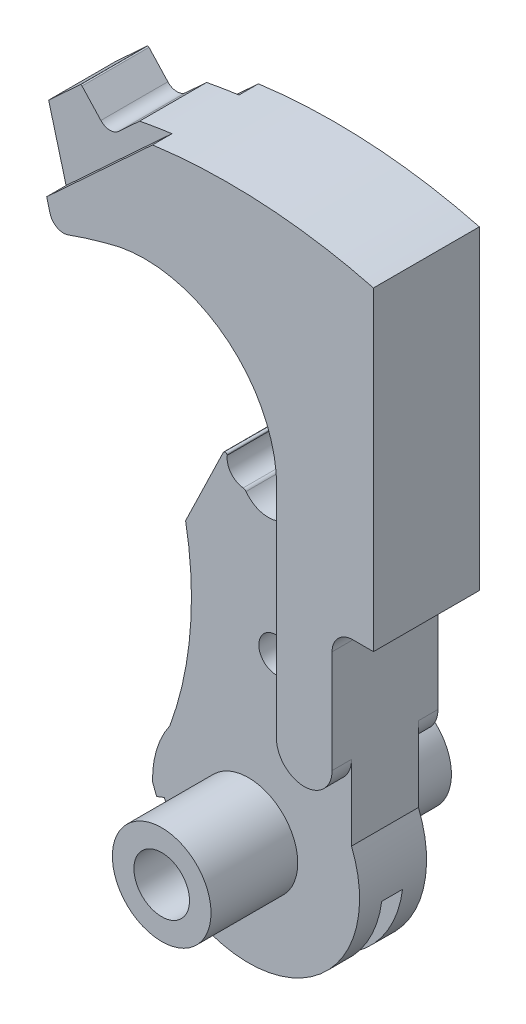
from build123d import *

# Parameters (mm, degrees)
SKETCH1_R               = 2
BOSS_EXTRUDE2_DEPTH     = 8.65
CUT_EXTRUDE3_START      = -4.84
SKETCH21_R              = 3.55
CUT_EXTRUDE3_DEPTH      = 4.84
SKETCH18_R              = 3.55
CUT_EXTRUDE4_DEPTH      = 4.84
SKETCH27_R              = 3.55
CUT_EXTRUDE7_DEPTH      = 1.4
CUT_EXTRUDE8_START      = -1.4
SKETCH29_R              = 3.55
CUT_EXTRUDE8_DEPTH      = 1.4
CUT_EXTRUDE9_DEPTH      = 45.578250281
CUT_EXTRUDE9_DEPTH_BACK = 45.578250281
SKETCH6_R               = 1.25
CUT_EXTRUDE10_DEPTH     = 0.75


with BuildPart() as part:
    # Sketch1 → Boss-Extrude2 (new, symmetric)
    with BuildSketch(Plane.XY):
        with BuildLine():
            ThreePointArc((-5.651629818, 3.958418927), (-6.605289058, 1.995032948), (-6.897954559, -0.167996721))
            Line((-6.897954559, -0.167996721), (-6.605824697, -0.929021032))
            Line((-6.605824697, -0.929021032), (-6.069015951, -0.722959461))
            ThreePointArc((-6.069015951, -0.722959461), (-6.049888336, -0.723460336), (-6.036717242, -0.737339773))
            Line((-6.036717242, -0.737339773), (-5.517083715, -2.091031392))
            ThreePointArc((-5.517083715, -2.091031392), (-5.517584589, -2.110159006), (-5.531464027, -2.123330101))
            Line((-5.531464027, -2.123330101), (-7.419958348, -2.848255151))
            Line((-7.419958348, -2.848255151), (-6.027342222, -5.260337036))
            ThreePointArc((-6.027342222, -5.260337036), (4.183814464, -6.818775296), (7.42, 2.990585227))
            Line((7.42, 2.990585227), (7.42, 9.395292614))
            Line((7.42, 9.395292614), (7.42, 15.8))
            ThreePointArc((7.42, 15.8), (7.859339828, 16.860660172), (8.92, 17.3))
            Line((8.92, 17.3), (10.4, 17.3))
            Line((10.4, 17.3), (10.4, 39.969113075))
            ThreePointArc((10.4, 39.969113075), (1.317615366, 41.278976365), (-7.82981649, 40.551004596))
            Line((-7.82981649, 40.551004596), (-9.346087248, 39.150359553))
            ThreePointArc((-9.346087248, 39.150359553), (-9.992424937, 38.912169279), (-10.617880658, 39.200773083))
            Line((-10.617880658, 39.200773083), (-11.974969412, 40.669891905))
            ThreePointArc((-11.974969412, 40.669891905), (-12.044464492, 40.701958995), (-12.116279791, 40.675493408))
            Line((-12.116279791, 40.675493408), (-14.377339743, 38.586854295))
            Line((-14.377339743, 38.586854295), (-12.872946932, 32.972383888))
            ThreePointArc((-12.872946932, 32.972383888), (-12.370989585, 32.345351225), (-11.569711725, 32.289809083))
            ThreePointArc((-11.569711725, 32.289809083), (-9.741406245, 32.887611716), (-7.882463977, 33.38198259))
            ThreePointArc((-7.882463977, 33.38198259), (-0.014271933, 31.38535878), (3.438957848, 24.038920408))
            Line((3.438957848, 24.038920408), (3.438957848, 22.483224896))
            ThreePointArc((3.438957848, 22.483224896), (2.06450625, 20.583569875), (-0.169731349, 21.294898734))
            ThreePointArc((-0.169731349, 21.294898734), (-0.261150212, 21.376524071), (-0.377583309, 21.41477898))
            ThreePointArc((-0.377583309, 21.41477898), (-1.257242701, 21.906570189), (-1.521126803, 22.879208054))
            Line((-1.521126803, 22.879208054), (-1.537067384, 22.913392739))
            ThreePointArc((-1.537067384, 22.913392739), (-1.671971186, 22.999996378), (-1.808065565, 22.91527598))
            Line((-1.808065565, 22.91527598), (-4.520599254, 17.303209571))
            ThreePointArc((-4.520599254, 17.303209571), (-4.190739584, 10.554927226), (-5.651629818, 3.958418927))
        make_face()
        Circle(SKETCH1_R, mode=Mode.SUBTRACT)
    extrude(amount=BOSS_EXTRUDE2_DEPTH, both=True)

    # Sketch21 → Cut-Extrude3 (cut)
    with BuildSketch(Plane(origin=(0, 0, -8.65), x_dir=(-1, 0, 0), z_dir=(0, 0, -1)).offset(CUT_EXTRUDE3_START)):
        with BuildLine():
            Line((12.872946932, 32.972383888), (14.377339743, 38.586854295))
            Line((14.377339743, 38.586854295), (12.116279791, 40.675493408))
            ThreePointArc((12.116279791, 40.675493408), (12.044464492, 40.701958995), (11.974969412, 40.669891905))
            Line((11.974969412, 40.669891905), (10.617880658, 39.200773083))
            ThreePointArc((10.617880658, 39.200773083), (9.992424937, 38.912169279), (9.346087248, 39.150359553))
            Line((9.346087248, 39.150359553), (7.82981649, 40.551004596))
            ThreePointArc((7.82981649, 40.551004596), (-1.317615366, 41.278976365), (-10.4, 39.969113075))
            Line((-10.4, 39.969113075), (-10.4, 17.3))
            Line((-10.4, 17.3), (-8.92, 17.3))
            ThreePointArc((-8.92, 17.3), (-7.859339828, 16.860660172), (-7.42, 15.8))
            Line((-7.42, 15.8), (-7.42, 9.395292614))
            Line((-7.42, 9.395292614), (-7.42, 2.990585227))
            ThreePointArc((-7.42, 2.990585227), (-4.183814464, -6.818775296), (6.027342222, -5.260337036))
            Line((6.027342222, -5.260337036), (7.419958348, -2.848255151))
            Line((7.419958348, -2.848255151), (5.531464027, -2.123330101))
            ThreePointArc((5.531464027, -2.123330101), (5.517584589, -2.110159006), (5.517083715, -2.091031392))
            Line((5.517083715, -2.091031392), (6.036717242, -0.737339773))
            ThreePointArc((6.036717242, -0.737339773), (6.049888336, -0.723460336), (6.069015951, -0.722959461))
            Line((6.069015951, -0.722959461), (6.605824697, -0.929021032))
            Line((6.605824697, -0.929021032), (6.897954559, -0.167996721))
            ThreePointArc((6.897954559, -0.167996721), (6.605289058, 1.995032948), (5.651629818, 3.958418927))
            ThreePointArc((5.651629818, 3.958418927), (4.190739584, 10.554927226), (4.520599254, 17.303209571))
            Line((4.520599254, 17.303209571), (1.808065565, 22.91527598))
            ThreePointArc((1.808065565, 22.91527598), (1.671971186, 22.999996378), (1.537067384, 22.913392739))
            Line((1.537067384, 22.913392739), (1.521126803, 22.879208054))
            ThreePointArc((1.521126803, 22.879208054), (1.257242701, 21.906570189), (0.377583309, 21.41477898))
            ThreePointArc((0.377583309, 21.41477898), (0.261150212, 21.376524071), (0.169731349, 21.294898734))
            ThreePointArc((0.169731349, 21.294898734), (-2.06450625, 20.583569875), (-3.438957848, 22.483224896))
            Line((-3.438957848, 22.483224896), (-3.438957848, 24.038920408))
            ThreePointArc((-3.438957848, 24.038920408), (0.014271933, 31.38535878), (7.882463977, 33.38198259))
            ThreePointArc((7.882463977, 33.38198259), (9.741406245, 32.887611716), (11.569711725, 32.289809083))
            ThreePointArc((11.569711725, 32.289809083), (12.370989585, 32.345351225), (12.872946932, 32.972383888))
        make_face()
        Circle(SKETCH21_R, mode=Mode.SUBTRACT)
    extrude(amount=CUT_EXTRUDE3_DEPTH, mode=Mode.SUBTRACT)

    # Sketch18 → Cut-Extrude4 (cut)
    with BuildSketch(Plane.XY.offset(8.65)):
        with BuildLine():
            ThreePointArc((-5.651629818, 3.958418927), (-6.605289058, 1.995032948), (-6.897954559, -0.167996721))
            Line((-6.897954559, -0.167996721), (-6.605824697, -0.929021032))
            Line((-6.605824697, -0.929021032), (-6.069015951, -0.722959461))
            ThreePointArc((-6.069015951, -0.722959461), (-6.049888336, -0.723460336), (-6.036717242, -0.737339773))
            Line((-6.036717242, -0.737339773), (-5.517083715, -2.091031392))
            ThreePointArc((-5.517083715, -2.091031392), (-5.517584589, -2.110159006), (-5.531464027, -2.123330101))
            Line((-5.531464027, -2.123330101), (-7.419958348, -2.848255151))
            Line((-7.419958348, -2.848255151), (-6.027342222, -5.260337036))
            ThreePointArc((-6.027342222, -5.260337036), (4.183814464, -6.818775296), (7.42, 2.990585227))
            Line((7.42, 2.990585227), (7.42, 9.395292614))
            Line((7.42, 9.395292614), (7.42, 15.8))
            ThreePointArc((7.42, 15.8), (7.859339828, 16.860660172), (8.92, 17.3))
            Line((8.92, 17.3), (10.4, 17.3))
            Line((10.4, 17.3), (10.4, 39.969113075))
            ThreePointArc((10.4, 39.969113075), (1.317615366, 41.278976365), (-7.82981649, 40.551004596))
            Line((-7.82981649, 40.551004596), (-9.346087248, 39.150359553))
            ThreePointArc((-9.346087248, 39.150359553), (-9.992424937, 38.912169279), (-10.617880658, 39.200773083))
            Line((-10.617880658, 39.200773083), (-11.974969412, 40.669891905))
            ThreePointArc((-11.974969412, 40.669891905), (-12.044464492, 40.701958995), (-12.116279791, 40.675493408))
            Line((-12.116279791, 40.675493408), (-14.377339743, 38.586854295))
            Line((-14.377339743, 38.586854295), (-12.872946932, 32.972383888))
            ThreePointArc((-12.872946932, 32.972383888), (-12.370989585, 32.345351225), (-11.569711725, 32.289809083))
            ThreePointArc((-11.569711725, 32.289809083), (-9.741406245, 32.887611716), (-7.882463977, 33.38198259))
            ThreePointArc((-7.882463977, 33.38198259), (-0.014271933, 31.38535878), (3.438957848, 24.038920408))
            Line((3.438957848, 24.038920408), (3.438957848, 22.483224896))
            ThreePointArc((3.438957848, 22.483224896), (2.06450625, 20.583569875), (-0.169731349, 21.294898734))
            ThreePointArc((-0.169731349, 21.294898734), (-0.261150212, 21.376524071), (-0.377583309, 21.41477898))
            ThreePointArc((-0.377583309, 21.41477898), (-1.257242701, 21.906570189), (-1.521126803, 22.879208054))
            Line((-1.521126803, 22.879208054), (-1.537067384, 22.913392739))
            ThreePointArc((-1.537067384, 22.913392739), (-1.671971186, 22.999996378), (-1.808065565, 22.91527598))
            Line((-1.808065565, 22.91527598), (-4.520599254, 17.303209571))
            ThreePointArc((-4.520599254, 17.303209571), (-4.190739584, 10.554927226), (-5.651629818, 3.958418927))
        make_face()
        with Locations(Location((0, 0, 0), (0, 0, 180))):
            Circle(SKETCH18_R, mode=Mode.SUBTRACT)
    extrude(amount=-CUT_EXTRUDE4_DEPTH, mode=Mode.SUBTRACT)

    # Sketch27 → Cut-Extrude7 (cut)
    # profile 1 of 2: a face of its own
    with BuildSketch(Plane.XY.offset(3.81)):
        with BuildLine():
            ThreePointArc((-5.651629818, 3.958418927), (-6.605289058, 1.995032948), (-6.897954559, -0.167996721))
            Line((-6.897954559, -0.167996721), (-6.605824697, -0.929021032))
            Line((-6.605824697, -0.929021032), (-6.069015951, -0.722959461))
            ThreePointArc((-6.069015951, -0.722959461), (-6.049888336, -0.723460336), (-6.036717242, -0.737339773))
            Line((-6.036717242, -0.737339773), (-5.517083715, -2.091031392))
            ThreePointArc((-5.517083715, -2.091031392), (-5.517584589, -2.110159006), (-5.531464027, -2.123330101))
            Line((-5.531464027, -2.123330101), (-7.419958348, -2.848255151))
            Line((-7.419958348, -2.848255151), (-6.027342222, -5.260337036))
            ThreePointArc((-6.027342222, -5.260337036), (4.183814464, -6.818775296), (7.42, 2.990585227))
            Line((7.42, 2.990585227), (7.42, 8.4))
            ThreePointArc((7.42, 8.4), (5.42, 6.4), (3.42, 8.4))
            Line((3.42, 8.4), (3.42, 22.208503231))
            ThreePointArc((3.42, 22.208503231), (1.932242731, 20.545011795), (-0.169731349, 21.294898734))
            ThreePointArc((-0.169731349, 21.294898734), (-0.261150212, 21.376524071), (-0.377583309, 21.41477898))
            ThreePointArc((-0.377583309, 21.41477898), (-1.257242701, 21.906570189), (-1.521126803, 22.879208054))
            Line((-1.521126803, 22.879208054), (-1.537067384, 22.913392739))
            ThreePointArc((-1.537067384, 22.913392739), (-1.671971186, 22.999996378), (-1.808065565, 22.91527598))
            Line((-1.808065565, 22.91527598), (-4.520599254, 17.303209571))
            ThreePointArc((-4.520599254, 17.303209571), (-4.190739584, 10.554927226), (-5.651629818, 3.958418927))
        make_face()
        with Locations(Location((0, 0, 0), (0, 0, 180))):
            Circle(SKETCH27_R, mode=Mode.SUBTRACT)
    # profile 2 of 2: a face of its own
    with BuildSketch(Plane.XY.offset(3.81)):
        with BuildLine():
            Line((-13.120014147, 33.89445129), (-5.501583304, 40.931926184))
            ThreePointArc((-5.501583304, 40.931926184), (-6.668420385, 40.758093301), (-7.82981649, 40.551004596))
            Line((-7.82981649, 40.551004596), (-9.346087248, 39.150359553))
            ThreePointArc((-9.346087248, 39.150359553), (-9.992424937, 38.912169279), (-10.617880658, 39.200773083))
            Line((-10.617880658, 39.200773083), (-11.974969412, 40.669891905))
            ThreePointArc((-11.974969412, 40.669891905), (-12.044464492, 40.701958995), (-12.116279791, 40.675493408))
            Line((-12.116279791, 40.675493408), (-14.377339743, 38.586854295))
            Line((-14.377339743, 38.586854295), (-13.120014147, 33.89445129))
        make_face()
    extrude(amount=-CUT_EXTRUDE7_DEPTH, mode=Mode.SUBTRACT)

    # Sketch29 → Cut-Extrude8 (cut)
    # profile 1 of 2: a face of its own
    with BuildSketch(Plane(origin=(0, 0, -3.81), x_dir=(-1, 0, 0), z_dir=(0, 0, -1)).offset(CUT_EXTRUDE8_START)):
        with BuildLine():
            Line((13.120014147, 33.89445129), (14.377339743, 38.586854295))
            Line((14.377339743, 38.586854295), (12.116279791, 40.675493408))
            ThreePointArc((12.116279791, 40.675493408), (12.044464492, 40.701958995), (11.974969412, 40.669891905))
            Line((11.974969412, 40.669891905), (10.617880658, 39.200773083))
            ThreePointArc((10.617880658, 39.200773083), (9.992424937, 38.912169279), (9.346087248, 39.150359553))
            Line((9.346087248, 39.150359553), (7.82981649, 40.551004596))
            ThreePointArc((7.82981649, 40.551004596), (6.668420385, 40.758093301), (5.501583304, 40.931926184))
            Line((5.501583304, 40.931926184), (13.120014147, 33.89445129))
        make_face()
    # profile 2 of 2: a face of its own
    with BuildSketch(Plane(origin=(0, 0, -3.81), x_dir=(-1, 0, 0), z_dir=(0, 0, -1)).offset(CUT_EXTRUDE8_START)):
        with BuildLine():
            ThreePointArc((0.169731349, 21.294898734), (-1.932242731, 20.545011795), (-3.42, 22.208503231))
            Line((-3.42, 22.208503231), (-3.42, 8.4))
            ThreePointArc((-3.42, 8.4), (-5.42, 6.4), (-7.42, 8.4))
            Line((-7.42, 8.4), (-7.42, 2.990585227))
            ThreePointArc((-7.42, 2.990585227), (-4.183814464, -6.818775296), (6.027342222, -5.260337036))
            Line((6.027342222, -5.260337036), (7.419958348, -2.848255151))
            Line((7.419958348, -2.848255151), (5.531464027, -2.123330101))
            ThreePointArc((5.531464027, -2.123330101), (5.517584589, -2.110159006), (5.517083715, -2.091031392))
            Line((5.517083715, -2.091031392), (6.036717242, -0.737339773))
            ThreePointArc((6.036717242, -0.737339773), (6.049888336, -0.723460336), (6.069015951, -0.722959461))
            Line((6.069015951, -0.722959461), (6.605824697, -0.929021032))
            Line((6.605824697, -0.929021032), (6.897954559, -0.167996721))
            ThreePointArc((6.897954559, -0.167996721), (6.605289058, 1.995032948), (5.651629818, 3.958418927))
            ThreePointArc((5.651629818, 3.958418927), (4.190739584, 10.554927226), (4.520599254, 17.303209571))
            Line((4.520599254, 17.303209571), (1.808065565, 22.91527598))
            ThreePointArc((1.808065565, 22.91527598), (1.671971186, 22.999996378), (1.537067384, 22.913392739))
            Line((1.537067384, 22.913392739), (1.521126803, 22.879208054))
            ThreePointArc((1.521126803, 22.879208054), (1.257242701, 21.906570189), (0.377583309, 21.41477898))
            ThreePointArc((0.377583309, 21.41477898), (0.261150212, 21.376524071), (0.169731349, 21.294898734))
        make_face()
        Circle(SKETCH29_R, mode=Mode.SUBTRACT)
    extrude(amount=CUT_EXTRUDE8_DEPTH, mode=Mode.SUBTRACT)

    # Sketch6 → Cut-Extrude9 (cut, two sides: drawn at the far end of the back side and taken through both)
    with BuildSketch(Plane.XY.offset(-CUT_EXTRUDE9_DEPTH_BACK)):
        with Locations((2, 12.2)):
            Circle(SKETCH6_R)
    extrude(amount=CUT_EXTRUDE9_DEPTH + CUT_EXTRUDE9_DEPTH_BACK, mode=Mode.SUBTRACT)

    # Sketch30 → Cut-Extrude10 (cut, symmetric)
    with BuildSketch(Plane.XY):
        with BuildLine():
            Line((7.934098321, -1.02473598), (-5.210501905, -6.070475262))
            ThreePointArc((-5.210501905, -6.070475262), (2.866943596, -7.468643412), (7.934098321, -1.02473598))
        make_face()
    extrude(amount=CUT_EXTRUDE10_DEPTH, both=True, mode=Mode.SUBTRACT)


solid = part.part
